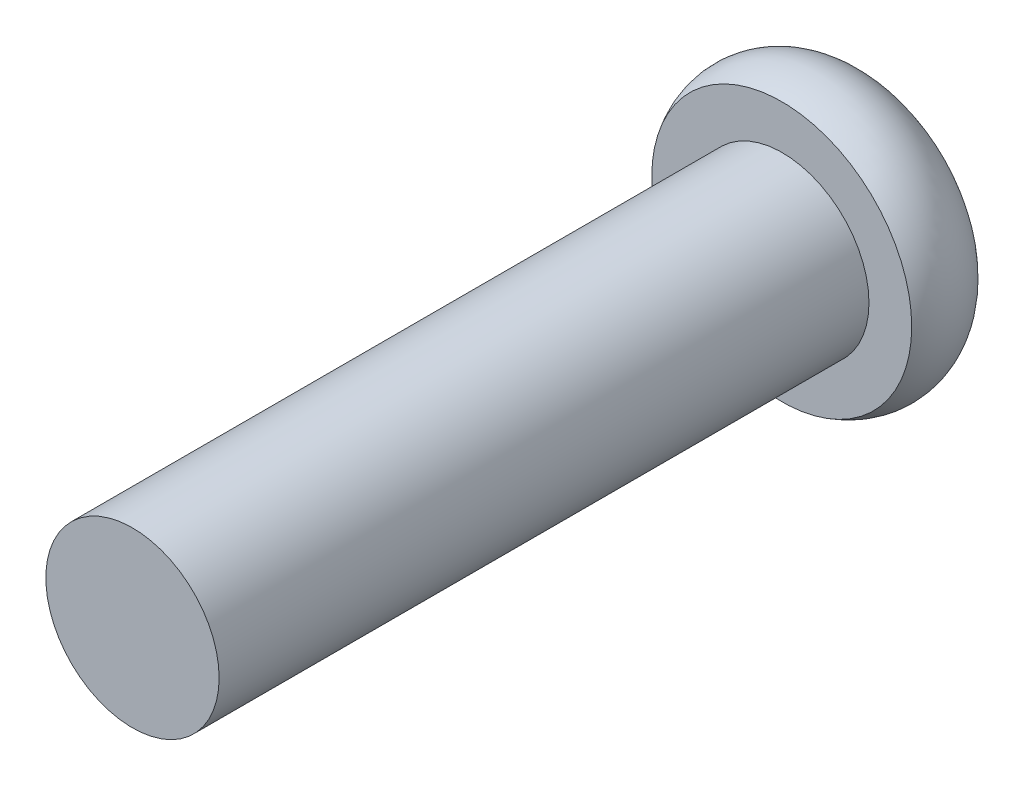
from build123d import *

# Parameters (mm, degrees)
CUT_EXTRUDE1_DEPTH  = 2
CUT_EXTRUDE1_DRAFT  = -12
SKETCH3_R           = 2
BOSS_EXTRUDE1_DEPTH = 15


with BuildPart() as part:
    # Sketch1 → Revolve2 (revolve)
    with BuildSketch(Plane(origin=(0, 0, 0), x_dir=(1, 0, 0), z_dir=(0, 1, 0))):
        with BuildLine():
            Line((0, 0), (0, 2))
            Line((0, 2), (2.298285661, 2))
            ThreePointArc((2.298285661, 2), (2.441964308, 1.978911731), (2.57352322, 1.917425786))
            ThreePointArc((2.57352322, 1.917425786), (3.174697589, 1.044998208), (3, 0))
            Line((3, 0), (0, 0))
        make_face()
    revolve(axis=Axis((0, 0, -0.65925001), (0, 0, -1)))


with BuildPart() as cut_extrude1_tool:
    # Sketch2 → Cut-Extrude1 (with draft: the straight prism first)
    with BuildSketch(Plane(origin=(0, 0, -2), x_dir=(-1, 0, 0), z_dir=(0, 0, -1))):
        Polygon((0.5, -0.5), (2, -0.5), (2, 0.5), (0.5, 0.5), (0.5, 2), (-0.5, 2), (-0.5, 0.5), (-2, 0.5), (-2, -0.5), (-0.5, -0.5), (-0.5, -2), (0.5, -2), align=None)
    extrude(amount=-CUT_EXTRUDE1_DEPTH)
    # Cut-Extrude1: the draft: its side faces are tilted about the plane it starts from
    cut_extrude1_sides = [cut_extrude1_tool.faces().sort_by_distance(p)[0] for p in [
        (-1.25, -0.5, -1),
        (-2, 0, -1),
        (-1.25, 0.5, -1),
        (-0.5, 1.25, -1),
        (0, 2, -1),
        (0.5, 1.25, -1),
        (1.25, 0.5, -1),
        (2, 0, -1),
        (1.25, -0.5, -1),
        (0.5, -1.25, -1),
        (0, -2, -1),
        (-0.5, -1.25, -1),
    ]]
    draft(cut_extrude1_sides, Plane(origin=(0, 0, -2), x_dir=(-1, 0, 0), z_dir=(0, 0, -1)), CUT_EXTRUDE1_DRAFT)


with BuildPart() as part_1:
    add(part.part)

    # Cut-Extrude1: cut by cut_extrude1_tool
    add(cut_extrude1_tool.part, mode=Mode.SUBTRACT)

    # Sketch3 → Boss-Extrude1 (add)
    with BuildSketch(Plane.XY):
        with Locations((0.013589602, -0.013589602)):
            Circle(SKETCH3_R)
    extrude(amount=BOSS_EXTRUDE1_DEPTH)


solid = part_1.part
